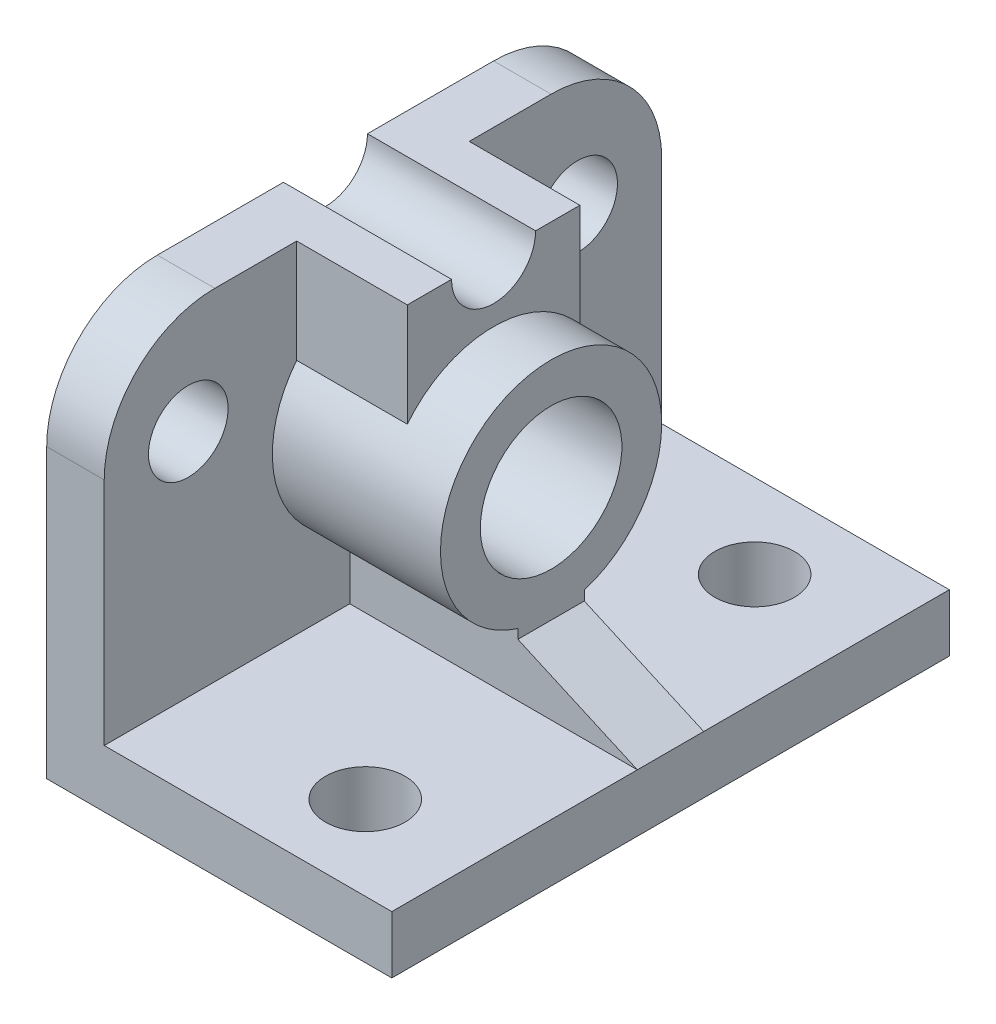
from build123d import *

# Parameters (mm, degrees)
SKETCH1_W                = 78
SKETCH1_H                = 126
SKETCH1_R                = 9
BOSS_EXTRUDE1_DEPTH      = 13
SKETCH2_R                = 9
BOSS_EXTRUDE2_DEPTH      = 13
BOSS_EXTRUDE3_DEPTH      = 38
SKETCH2_4_R              = 25
SKETCH2_4_R_2            = 16
BOSS_EXTRUDE4_DEPTH      = 51
BOSS_EXTRUDE5_DEPTH      = 7.5
BOSS_EXTRUDE6_REACH      = 100.539
BOSS_EXTRUDE6_END_RADIUS = 25
SKETCH4_W                = 38
SKETCH4_H                = 15


with BuildPart() as part:
    # Sketch1 → Boss-Extrude1 (new body)
    with BuildSketch(Plane(origin=(0, 0, 0), x_dir=(1, 0, 0), z_dir=(0, 1, 0))):
        Rectangle(SKETCH1_W, SKETCH1_H)
        with Locations((14, -44)):
            Circle(SKETCH1_R, mode=Mode.SUBTRACT)
        with Locations((14, 44)):
            Circle(SKETCH1_R, mode=Mode.SUBTRACT)
    extrude(amount=BOSS_EXTRUDE1_DEPTH)

    # Sketch2 → Boss-Extrude2 (add)
    with BuildSketch(Plane.ZY.offset(39)):
        with BuildLine():
            Line((63, 13), (63, 65))
            ThreePointArc((63, 65), (55.67766953, 82.67766953), (38, 90))
            Line((38, 90), (19.5, 90))
            Line((19.5, 90), (19.5, 66.644487847))
            ThreePointArc((19.5, 66.644487847), (0, 26), (-19.5, 66.644487847))
            Line((-19.5, 66.644487847), (-19.5, 90))
            Line((-19.5, 90), (-38, 90))
            ThreePointArc((-38, 90), (-55.67766953, 82.67766953), (-63, 65))
            Line((-63, 65), (-63, 13))
            Line((-63, 13), (63, 13))
        make_face()
        with Locations((44, 65)):
            Circle(SKETCH2_R, mode=Mode.SUBTRACT)
        with Locations((-44, 65)):
            Circle(SKETCH2_R, mode=Mode.SUBTRACT)
    extrude(amount=-BOSS_EXTRUDE2_DEPTH)

    # Sketch2<3> → Boss-Extrude3 (add)
    with BuildSketch(Plane.ZY.offset(39)):
        with BuildLine():
            Line((19.5, 66.644487847), (19.5, 90))
            Line((19.5, 90), (9.5, 90))
            ThreePointArc((9.5, 90), (0, 80.5), (-9.5, 90))
            Line((-9.5, 90), (-19.5, 90))
            Line((-19.5, 90), (-19.5, 66.644487847))
            ThreePointArc((-19.5, 66.644487847), (0, 76), (19.5, 66.644487847))
        make_face()
    extrude(amount=-BOSS_EXTRUDE3_DEPTH)

    # Sketch2<4> → Boss-Extrude4 (add)
    with BuildSketch(Plane.ZY.offset(39)):
        with Locations((0, 51)):
            Circle(SKETCH2_4_R)
        with Locations((0, 51)):
            Circle(SKETCH2_4_R_2, mode=Mode.SUBTRACT)
    extrude(amount=-BOSS_EXTRUDE4_DEPTH)

    # Sketch3 → Boss-Extrude5 (add, symmetric)
    with BuildSketch(Plane.XY):
        Polygon((-26, 13), (39, 13), (12, 25.03887683), (-26, 25.03887683), align=None)
    extrude(amount=BOSS_EXTRUDE5_DEPTH, both=True)

    # Boss-Extrude6: up to this cylinder (the profile starts outside it)
    boss_extrude6_end = Plane(origin=(-7, 51, 0), z_dir=(-1, 0, 0)) * Cylinder(BOSS_EXTRUDE6_END_RADIUS, 252.078, mode=Mode.PRIVATE)
    # Sketch4 → Boss-Extrude6 (add, up to the surface)
    with BuildSketch(Plane(origin=(0, 25.03887683, 0), x_dir=(1, 0, 0), z_dir=(0, 1, 0)), mode=Mode.PRIVATE) as boss_extrude6_sk1:
        with Locations((-7, 0)):
            Rectangle(SKETCH4_W, SKETCH4_H)
    boss_extrude6_tool1 = extrude(boss_extrude6_sk1.sketch, amount=BOSS_EXTRUDE6_REACH, mode=Mode.PRIVATE) - boss_extrude6_end
    add(boss_extrude6_tool1.solids().sort_by_distance((-7, 25.038877, 0))[0])


solid = part.part
